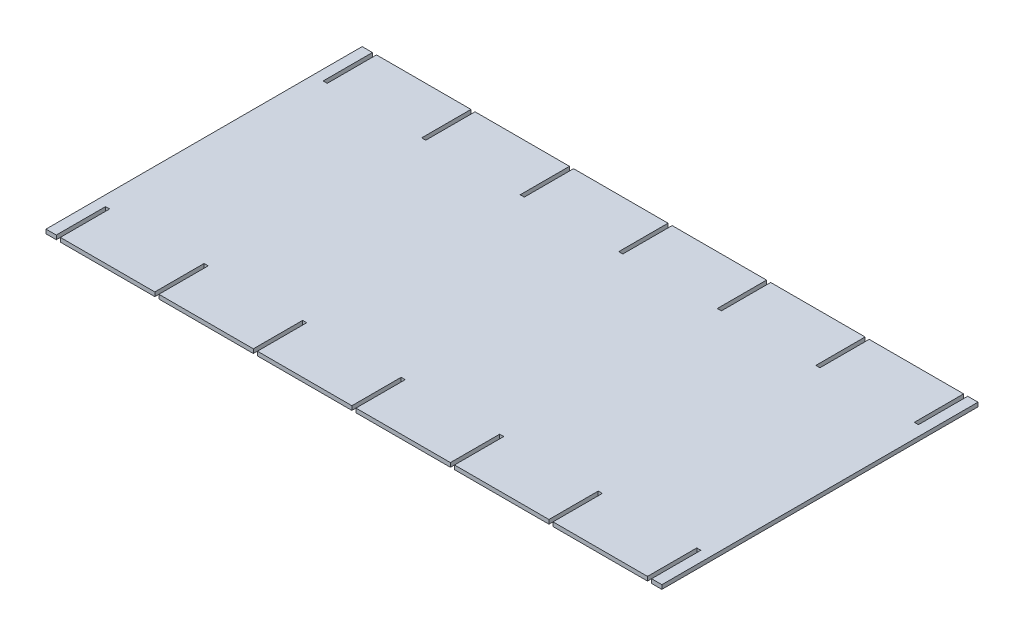
from build123d import *

# Parameters (mm, degrees)
SKETCH1_W               = 300
SKETCH1_H               = 154
BOSS_EXTRUDE1_DEPTH     = 2
CUT_EXTRUDE1_REACH      = 170.621
SKETCH2_W               = 2
SKETCH2_H               = 24
LPATTERN1_COUNT         = 7
LPATTERN1_PITCH         = 48
MIRROR1_COPY_1_REACH    = 170.621
MIRROR1_COPY_1_SKETCH_W = 2
MIRROR1_COPY_1_SKETCH_H = 24
MIRROR1_COPY_2_REACH    = 170.621
MIRROR1_COPY_2_SKETCH_W = 2
MIRROR1_COPY_2_SKETCH_H = 24
MIRROR1_COPY_3_REACH    = 170.621
MIRROR1_COPY_3_SKETCH_W = 2
MIRROR1_COPY_3_SKETCH_H = 24
MIRROR1_COPY_4_REACH    = 170.621
MIRROR1_COPY_4_SKETCH_W = 2
MIRROR1_COPY_4_SKETCH_H = 24
MIRROR1_COPY_5_REACH    = 170.621
MIRROR1_COPY_5_SKETCH_W = 2
MIRROR1_COPY_5_SKETCH_H = 24
MIRROR1_COPY_6_REACH    = 170.621
MIRROR1_COPY_6_SKETCH_W = 2
MIRROR1_COPY_6_SKETCH_H = 24


with BuildPart() as part:
    # Sketch1 → Boss-Extrude1 (new body)
    with BuildSketch(Plane(origin=(0, 0, 0), x_dir=(1, 0, 0), z_dir=(0, 1, 0))):
        Rectangle(SKETCH1_W, SKETCH1_H)
    extrude(amount=BOSS_EXTRUDE1_DEPTH)

    # Sketch2 → Cut-Extrude1 (cut, up to next)
    with BuildSketch(Plane(origin=(0, 2, 0), x_dir=(1, 0, 0), z_dir=(0, 1, 0)), mode=Mode.PRIVATE) as cut_extrude1_sk1:
        with Locations((-144, -65)):
            Rectangle(SKETCH2_W, SKETCH2_H)
    cut_extrude1_tool1 = extrude(cut_extrude1_sk1.sketch, amount=-CUT_EXTRUDE1_REACH, mode=Mode.PRIVATE) & part.part
    cut_extrude1 = cut_extrude1_tool1.solids().sort_by_distance((-144, 2, 65))[0]
    add(cut_extrude1, mode=Mode.SUBTRACT)

    # LPattern1: Cut-Extrude1 ×7
    with Locations(*[(i * LPATTERN1_PITCH, 0, 0) for i in range(1, LPATTERN1_COUNT)]):
        add(cut_extrude1, mode=Mode.SUBTRACT)

    # Mirror1: Cut-Extrude1 across plane
    add(cut_extrude1.mirror(Plane.XY), mode=Mode.SUBTRACT)

    # Mirror1 copy 1 sketch → Mirror1 copy 1 (cut, up to next)
    with BuildSketch(Plane(origin=(48, 2, 0), x_dir=(1, 0, 0), z_dir=(0, 1, 0)), mode=Mode.PRIVATE) as mirror1_copy_1_sk1:
        with Locations((-144, 65)):
            Rectangle(MIRROR1_COPY_1_SKETCH_W, MIRROR1_COPY_1_SKETCH_H)
    mirror1_copy_1_tool1 = extrude(mirror1_copy_1_sk1.sketch, amount=-MIRROR1_COPY_1_REACH, mode=Mode.PRIVATE) & part.part
    add(mirror1_copy_1_tool1.solids().sort_by_distance((-96, 2, -65))[0], mode=Mode.SUBTRACT)

    # Mirror1 copy 2 sketch → Mirror1 copy 2 (cut, up to next)
    with BuildSketch(Plane(origin=(96, 2, 0), x_dir=(1, 0, 0), z_dir=(0, 1, 0)), mode=Mode.PRIVATE) as mirror1_copy_2_sk1:
        with Locations((-144, 65)):
            Rectangle(MIRROR1_COPY_2_SKETCH_W, MIRROR1_COPY_2_SKETCH_H)
    mirror1_copy_2_tool1 = extrude(mirror1_copy_2_sk1.sketch, amount=-MIRROR1_COPY_2_REACH, mode=Mode.PRIVATE) & part.part
    add(mirror1_copy_2_tool1.solids().sort_by_distance((-48, 2, -65))[0], mode=Mode.SUBTRACT)

    # Mirror1 copy 3 sketch → Mirror1 copy 3 (cut, up to next)
    with BuildSketch(Plane(origin=(144, 2, 0), x_dir=(1, 0, 0), z_dir=(0, 1, 0)), mode=Mode.PRIVATE) as mirror1_copy_3_sk1:
        with Locations((-144, 65)):
            Rectangle(MIRROR1_COPY_3_SKETCH_W, MIRROR1_COPY_3_SKETCH_H)
    mirror1_copy_3_tool1 = extrude(mirror1_copy_3_sk1.sketch, amount=-MIRROR1_COPY_3_REACH, mode=Mode.PRIVATE) & part.part
    add(mirror1_copy_3_tool1.solids().sort_by_distance((0, 2, -65))[0], mode=Mode.SUBTRACT)

    # Mirror1 copy 4 sketch → Mirror1 copy 4 (cut, up to next)
    with BuildSketch(Plane(origin=(192, 2, 0), x_dir=(1, 0, 0), z_dir=(0, 1, 0)), mode=Mode.PRIVATE) as mirror1_copy_4_sk1:
        with Locations((-144, 65)):
            Rectangle(MIRROR1_COPY_4_SKETCH_W, MIRROR1_COPY_4_SKETCH_H)
    mirror1_copy_4_tool1 = extrude(mirror1_copy_4_sk1.sketch, amount=-MIRROR1_COPY_4_REACH, mode=Mode.PRIVATE) & part.part
    add(mirror1_copy_4_tool1.solids().sort_by_distance((48, 2, -65))[0], mode=Mode.SUBTRACT)

    # Mirror1 copy 5 sketch → Mirror1 copy 5 (cut, up to next)
    with BuildSketch(Plane(origin=(240, 2, 0), x_dir=(1, 0, 0), z_dir=(0, 1, 0)), mode=Mode.PRIVATE) as mirror1_copy_5_sk1:
        with Locations((-144, 65)):
            Rectangle(MIRROR1_COPY_5_SKETCH_W, MIRROR1_COPY_5_SKETCH_H)
    mirror1_copy_5_tool1 = extrude(mirror1_copy_5_sk1.sketch, amount=-MIRROR1_COPY_5_REACH, mode=Mode.PRIVATE) & part.part
    add(mirror1_copy_5_tool1.solids().sort_by_distance((96, 2, -65))[0], mode=Mode.SUBTRACT)

    # Mirror1 copy 6 sketch → Mirror1 copy 6 (cut, up to next)
    with BuildSketch(Plane(origin=(288, 2, 0), x_dir=(1, 0, 0), z_dir=(0, 1, 0)), mode=Mode.PRIVATE) as mirror1_copy_6_sk1:
        with Locations((-144, 65)):
            Rectangle(MIRROR1_COPY_6_SKETCH_W, MIRROR1_COPY_6_SKETCH_H)
    mirror1_copy_6_tool1 = extrude(mirror1_copy_6_sk1.sketch, amount=-MIRROR1_COPY_6_REACH, mode=Mode.PRIVATE) & part.part
    add(mirror1_copy_6_tool1.solids().sort_by_distance((144, 2, -65))[0], mode=Mode.SUBTRACT)


solid = part.part
